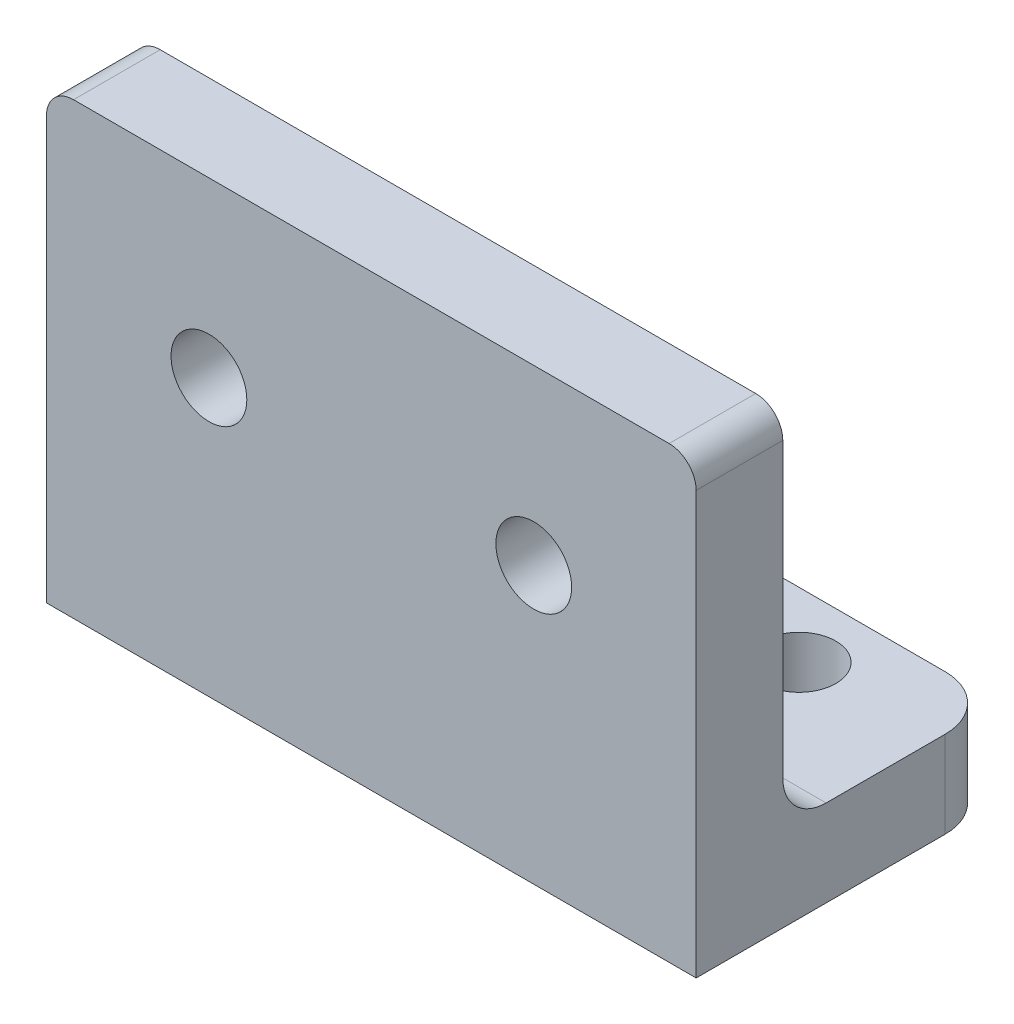
from build123d import *

# Parameters (mm, degrees)
SKETCH1_W                = 30
SKETCH1_H                = 20.75
BOSS_EXTRUDE1_DEPTH      = 4
FILLET1_R                = 1.25
SKETCH3_R                = 1.75
CUT_EXTRUDE1_DEPTH       = 10
SKETCH4_W                = 30
SKETCH4_H                = 4
BOSS_EXTRUDE2_DEPTH      = 10
FILLET2_R                = 2.5
FILLET3_R                = 2
M3_CLEARANCE_HOLE1_D     = 3.4
M3_CLEARANCE_HOLE1_DEPTH = 16
M3_CLEARANCE_HOLE1_TIP   = 1.021463052


with BuildPart() as part:
    # Sketch1 → Boss-Extrude1 (new body)
    with BuildSketch(Plane.XY):
        Rectangle(SKETCH1_W, SKETCH1_H)
    extrude(amount=BOSS_EXTRUDE1_DEPTH)

    # Fillet1
    fillet1_edges = [part.edges().sort_by_distance(p)[0] for p in [
        (-15, 10.375, 2),
        (15, 10.375, 2),
    ]]
    fillet(fillet1_edges, radius=FILLET1_R)

    # Sketch3 → Cut-Extrude1 (cut)
    with BuildSketch(Plane.XY.offset(4)):
        with Locations((-7.5, 2.375)):
            Circle(SKETCH3_R)
        with Locations((7.5, 2.375)):
            Circle(SKETCH3_R)
    extrude(amount=-CUT_EXTRUDE1_DEPTH, mode=Mode.SUBTRACT)

    # Sketch4 → Boss-Extrude2 (add)
    with BuildSketch(Plane(origin=(0, 0, 0), x_dir=(-1, 0, 0), z_dir=(0, 0, -1))):
        with Locations((0, -8.375)):
            Rectangle(SKETCH4_W, SKETCH4_H)
    extrude(amount=BOSS_EXTRUDE2_DEPTH)

    # Fillet2
    fillet2_edges = [part.edges().sort_by_distance(p)[0] for p in [
        (15, -8.375, -10),
        (-15, -8.375, -10),
    ]]
    fillet(fillet2_edges, radius=FILLET2_R)

    # Fillet3
    fillet3_edges = [part.edges().sort_by_distance(p)[0] for p in [
        (0, -6.375, 0),
    ]]
    fillet(fillet3_edges, radius=FILLET3_R)

    # M3 Clearance Hole1
    with Locations(Plane(origin=(0, -10.375, 0), x_dir=(-1, 0, 0), z_dir=(0, -1, 0))):
        with Locations((-8.75, 7), (8.75, 7)):
            Hole(M3_CLEARANCE_HOLE1_D / 2, depth=M3_CLEARANCE_HOLE1_DEPTH)
            with Locations((0, 0, -(M3_CLEARANCE_HOLE1_DEPTH + M3_CLEARANCE_HOLE1_TIP / 2))):  # 118° drill point
                Cone(0, M3_CLEARANCE_HOLE1_D / 2, M3_CLEARANCE_HOLE1_TIP, mode=Mode.SUBTRACT)


solid = part.part
